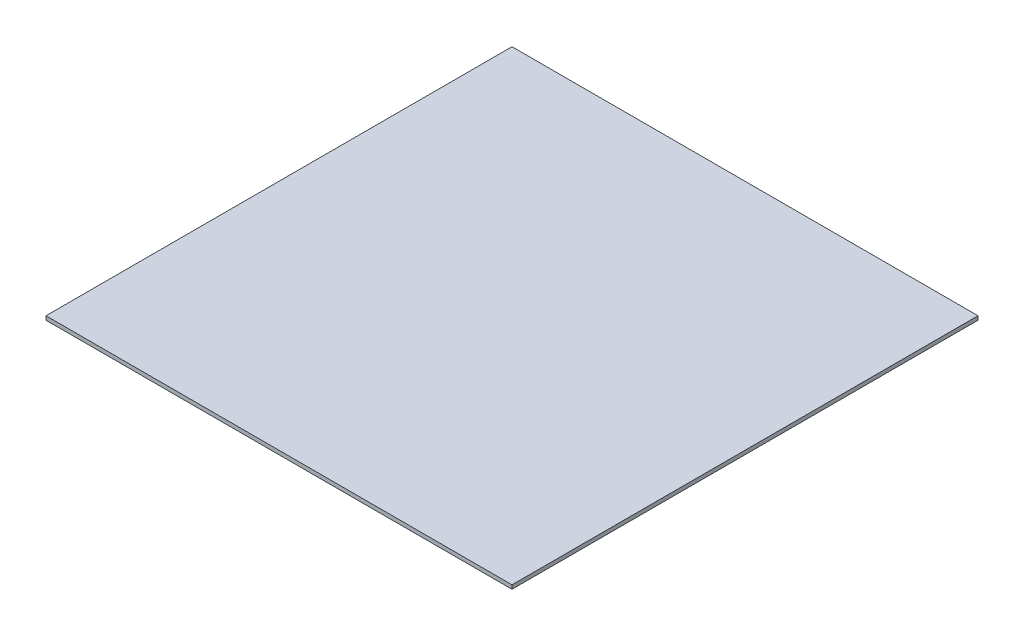
from build123d import *

# Parameters (mm, degrees)
SKETCH1_W           = 152.4
SKETCH1_H           = 152.4
BOSS_EXTRUDE1_DEPTH = 1.27


with BuildPart() as part:
    # Sketch1 → Boss-Extrude1 (new body)
    with BuildSketch(Plane(origin=(0, 0, 0), x_dir=(1, 0, 0), z_dir=(0, 1, 0))):
        Rectangle(SKETCH1_W, SKETCH1_H)
    extrude(amount=BOSS_EXTRUDE1_DEPTH)


solid = part.part
